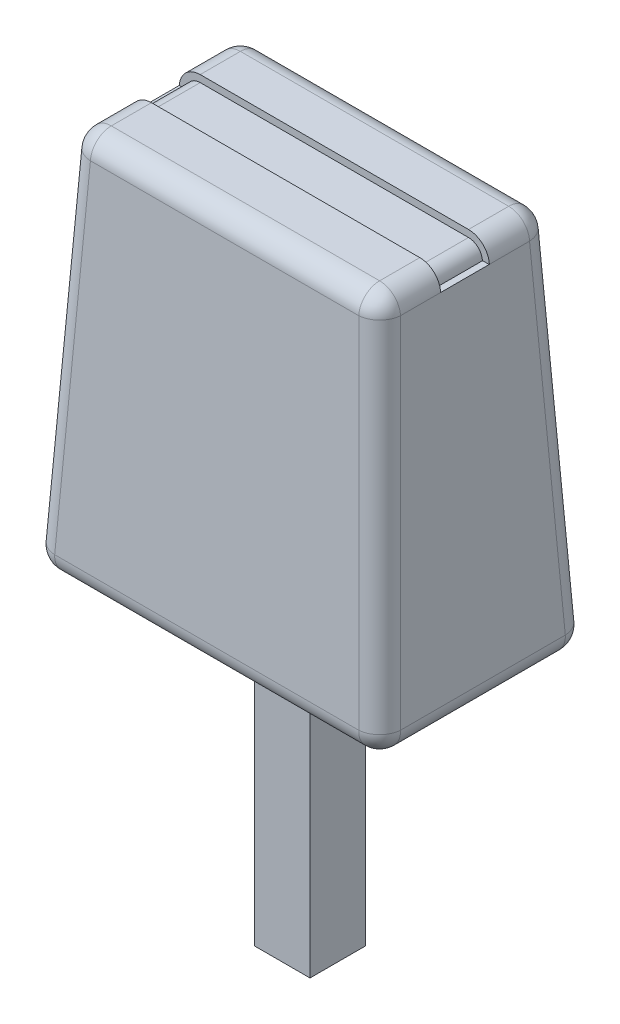
from build123d import *

# Parameters (mm, degrees)
SKETCH1_W           = 25
SKETCH1_H           = 15
BOSS_EXTRUDE1_DEPTH = 27.5
BOSS_EXTRUDE1_TAPER = 3
FILLET1_R           = 1.5
SKETCH2_W           = 4
SKETCH2_H           = 4
BOSS_EXTRUDE2_DEPTH = 21
CUT_EXTRUDE1_DEPTH  = 1.75


with BuildPart() as part:
    # Sketch1 → Boss-Extrude1 (new body)
    with BuildSketch(Plane(origin=(0, 0, 0), x_dir=(1, 0, 0), z_dir=(0, 1, 0))):
        Rectangle(SKETCH1_W, SKETCH1_H)
    extrude(amount=BOSS_EXTRUDE1_DEPTH, taper=BOSS_EXTRUDE1_TAPER)

    # Fillet1
    fillet1_edges = [part.edges().sort_by_distance(p)[0] for p in [
        (-11.05878607, 27.5, 0),
        (0, 27.5, 6.05878607),
        (11.05878607, 27.5, 0),
        (0, 0, 7.5),
        (-12.5, 0, 0),
        (0, 0, -7.5),
        (12.5, 0, 0),
        (11.779393035, 13.75, 6.779393035),
        (-11.779393035, 13.75, 6.779393035),
        (-11.779393035, 13.75, -6.779393035),
        (11.779393035, 13.75, -6.779393035),
        (0, 27.5, -6.05878607),
    ]]
    fillet(fillet1_edges, radius=FILLET1_R)

    # Sketch2 → Boss-Extrude2 (add)
    with BuildSketch(Plane(origin=(0, 0, 0), x_dir=(-1, 0, 0), z_dir=(0, -1, 0))):
        Rectangle(SKETCH2_W, SKETCH2_H)
    extrude(amount=BOSS_EXTRUDE2_DEPTH)

    # Sketch3 → Cut-Extrude1 (cut, symmetric)
    with BuildSketch(Plane.XY):
        with BuildLine():
            Line((-9.63533922, 27.5), (9.63533922, 27.5))
            ThreePointArc((9.63533922, 27.5), (10.667871083, 27.088061557), (11.133283522, 26.078503934))
            Line((11.133283522, 26.078503934), (10.633968754, 26.052335956))
            ThreePointArc((10.633968754, 26.052335956), (10.323693795, 26.725374371), (9.63533922, 27))
            Line((9.63533922, 27), (-9.63533922, 27))
            ThreePointArc((-9.63533922, 27), (-10.323693795, 26.725374371), (-10.633968754, 26.052335956))
            Line((-10.633968754, 26.052335956), (-11.133283522, 26.078503934))
            ThreePointArc((-11.133283522, 26.078503934), (-10.667871083, 27.088061557), (-9.63533922, 27.5))
        make_face()
    extrude(amount=CUT_EXTRUDE1_DEPTH, both=True, mode=Mode.SUBTRACT)


solid = part.part
